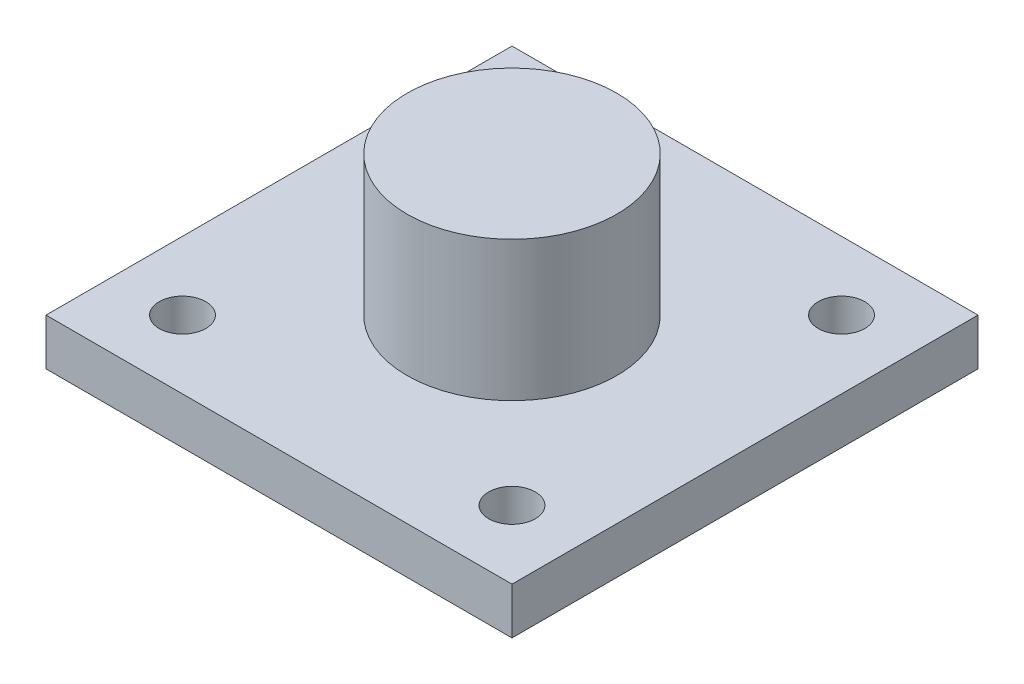
from build123d import *

# Parameters (mm, degrees)
SKETCH1_W           = 100
SKETCH1_H           = 100
SKETCH1_R           = 5
BOSS_EXTRUDE1_DEPTH = 10
SKETCH2_R           = 22.5
BOSS_EXTRUDE2_DEPTH = 30


with BuildPart() as part:
    # Sketch1 → Boss-Extrude1 (new body)
    with BuildSketch(Plane(origin=(0, 0, 0), x_dir=(1, 0, 0), z_dir=(0, 1, 0))):
        Rectangle(SKETCH1_W, SKETCH1_H)
        with Locations(Location((35.355339059, 35.355339059, 0), (0, 0, 270))):
            Circle(SKETCH1_R, mode=Mode.SUBTRACT)
        with Locations(Location((-35.355339059, 35.355339059, 0), (0, 0, 90))):
            Circle(SKETCH1_R, mode=Mode.SUBTRACT)
        with Locations(Location((-35.355339059, -35.355339059, 0), (0, 0, 270))):
            Circle(SKETCH1_R, mode=Mode.SUBTRACT)
        with Locations(Location((35.355339059, -35.355339059, 0), (0, 0, 90))):
            Circle(SKETCH1_R, mode=Mode.SUBTRACT)
    extrude(amount=BOSS_EXTRUDE1_DEPTH)

    # Sketch2 → Boss-Extrude2 (add)
    with BuildSketch(Plane(origin=(0, 10, 0), x_dir=(1, 0, 0), z_dir=(0, 1, 0))):
        with Locations(Location((0, 0, 0), (0, 0, 270))):
            Circle(SKETCH2_R)
    extrude(amount=BOSS_EXTRUDE2_DEPTH)


solid = part.part
